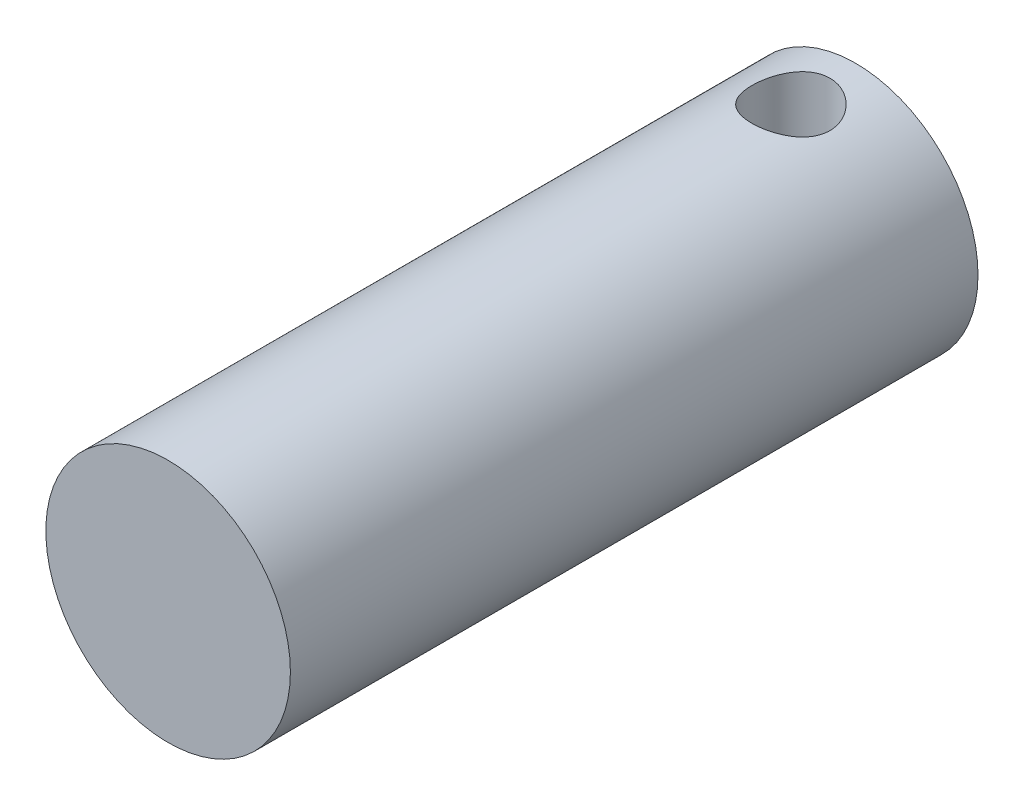
from build123d import *

# Parameters (mm, degrees)
SKETCH1_R           = 3.975
BOSS_EXTRUDE1_DEPTH = 11.176
SKETCH2_R           = 1.27
CUT_EXTRUDE1_DEPTH  = 6.35


with BuildPart() as part:
    # Sketch1 → Boss-Extrude1 (new, symmetric)
    with BuildSketch(Plane.XY):
        Circle(SKETCH1_R)
    extrude(amount=BOSS_EXTRUDE1_DEPTH, both=True)

    # Sketch2 → Cut-Extrude1 (cut, symmetric)
    with BuildSketch(Plane(origin=(0, 0, 0), x_dir=(1, 0, 0), z_dir=(0, 1, 0))):
        with Locations(Location((0, 9.0678, 0), (0, 0, 270))):
            Circle(SKETCH2_R)
    extrude(amount=CUT_EXTRUDE1_DEPTH, both=True, mode=Mode.SUBTRACT)


solid = part.part
